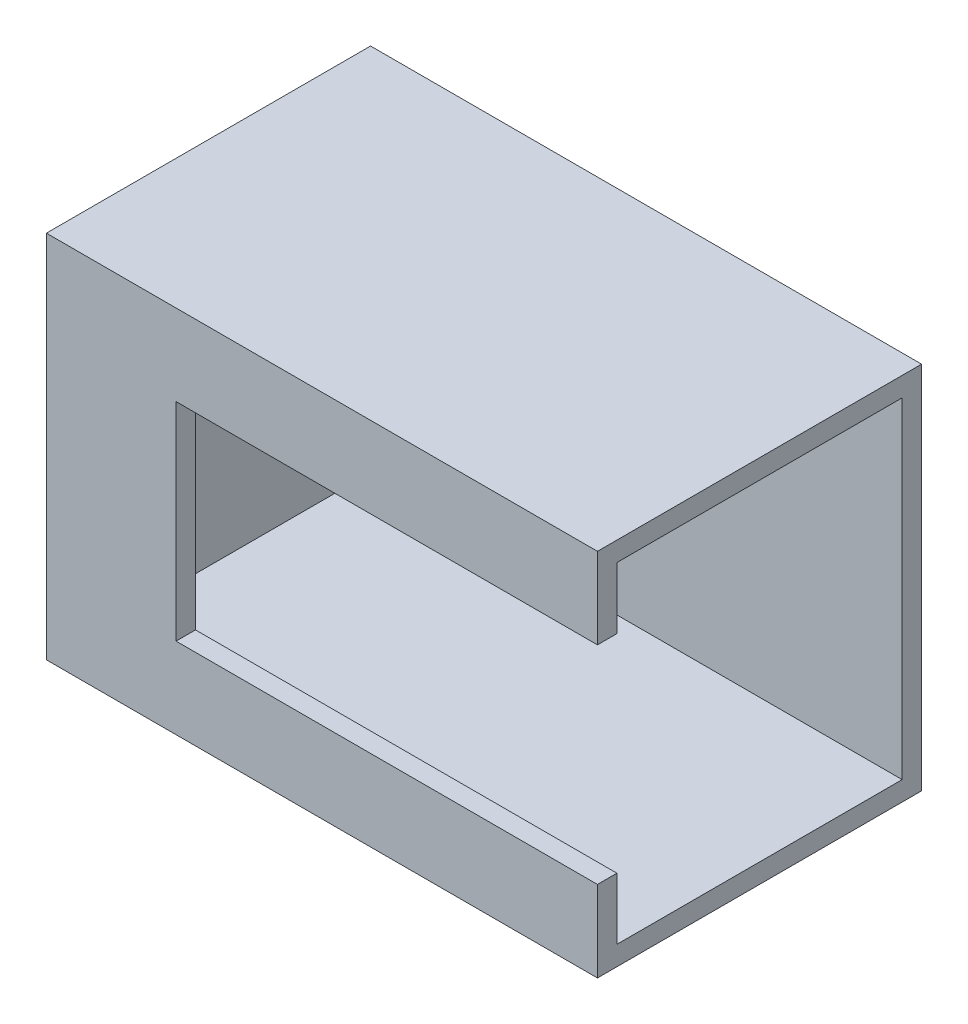
from build123d import *

# Parameters (mm, degrees)
SKETCH_1_W          = 85
SKETCH_1_H          = 50
EXTRUDE_1_DEPTH     = 57
SKETCH_3_W          = 22
SKETCH_3_H          = 51
CUT_EXTRUDE_2_DEPTH = 82
CUT_EXTRUDE_4_REACH = 88.921
SKETCH_4_W          = 65
SKETCH_4_H          = 32


with BuildPart() as part:
    # 草图1 → 凸台-拉伸1 (new body)
    with BuildSketch(Plane(origin=(0, 0, 0), x_dir=(1, 0, 0), z_dir=(0, 1, 0))):
        Rectangle(SKETCH_1_W, SKETCH_1_H)
    extrude(amount=EXTRUDE_1_DEPTH)

    # 草图3 → 切除-拉伸2 (cut)
    with BuildSketch(Plane(origin=(42.5, 0, 0), x_dir=(0, 0, -1), z_dir=(1, 0, 0))):
        with Locations((-11, 28.5)):
            Rectangle(SKETCH_3_W, SKETCH_3_H)
        with Locations((11, 28.5)):
            Rectangle(SKETCH_3_W, SKETCH_3_H)
    extrude(amount=-CUT_EXTRUDE_2_DEPTH, mode=Mode.SUBTRACT)

    # 草图4 → 切除-拉伸4 (cut, up to next)
    with BuildSketch(Plane.XY.offset(25), mode=Mode.PRIVATE) as cut_extrude_4_sk1:
        with Locations((10, 28.5)):
            Rectangle(SKETCH_4_W, SKETCH_4_H)
    cut_extrude_4_tool1 = extrude(cut_extrude_4_sk1.sketch, amount=-CUT_EXTRUDE_4_REACH, mode=Mode.PRIVATE) & part.part
    add(cut_extrude_4_tool1.solids().sort_by_distance((10, 28.5, 25))[0], mode=Mode.SUBTRACT)


solid = part.part
